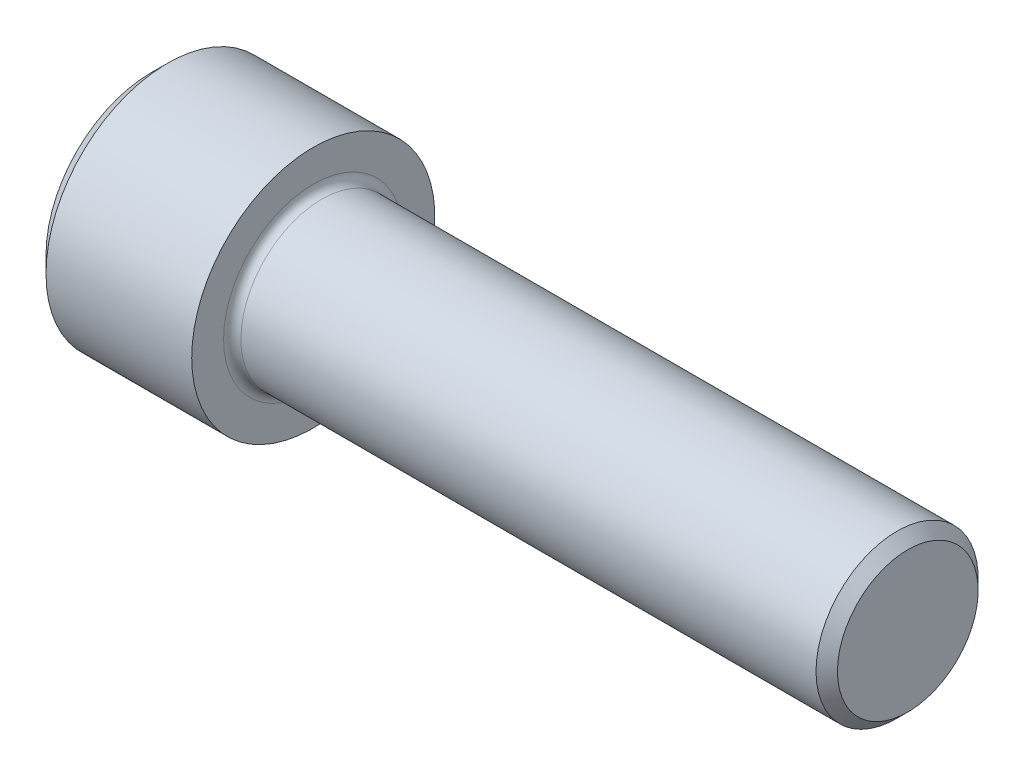
from build123d import *

# Parameters (mm, degrees)
FILLET1_R   = 0.508
HEX_2_DEPTH = 4.6228


with BuildPart() as part:
    # BodySke → Base-Revolve (revolve)
    with BuildSketch(Plane.XY, mode=Mode.PRIVATE) as base_revolve_sk:
        Polygon((0, 0), (0, 6.17855), (0.9652, 7.14375), (9.525, 7.14375), (9.525, 4.7625), (43.82008, 4.7625), (44.45, 4.13258), (44.45, 0), align=None)
    revolve(base_revolve_sk.sketch.rotate(Axis((-31.75, 0, 0), (1, 0, 0)), 90), axis=Axis((-31.75, 0, 0), (1, 0, 0)))

    # Fillet1
    fillet1_edges = [part.edges().sort_by_distance(p)[0] for p in [
        (9.525, 0, -4.7625),
    ]]
    fillet(fillet1_edges, radius=FILLET1_R)

    # Sketch2 → Hex-PreBroach (revolve, cut)
    with BuildSketch(Plane.XY, mode=Mode.PRIVATE) as hex_prebroach_sk:
        Polygon((0, 3.96875), (4.6228, 3.96875), (6.914158881, 0), (0, 0), align=None)
    revolve(hex_prebroach_sk.sketch.rotate(Axis((0, 0, 0), (1, 0, 0)), 90), axis=Axis((0, 0, 0), (1, 0, 0)), mode=Mode.SUBTRACT)

    # Sketch3 → Hex 2 (cut)
    with BuildSketch(Plane(origin=(0, 0, 0), x_dir=(0, 0.500000000000001, 0.866025403784438), z_dir=(-1, 0, 0))):
        Polygon((2.291358881, 3.96875), (-2.291358881, 3.96875), (-4.582717762, 0), (-2.291358881, -3.96875), (2.291358881, -3.96875), (4.582717762, 0), align=None)
    extrude(amount=-HEX_2_DEPTH, mode=Mode.SUBTRACT)


solid = part.part
